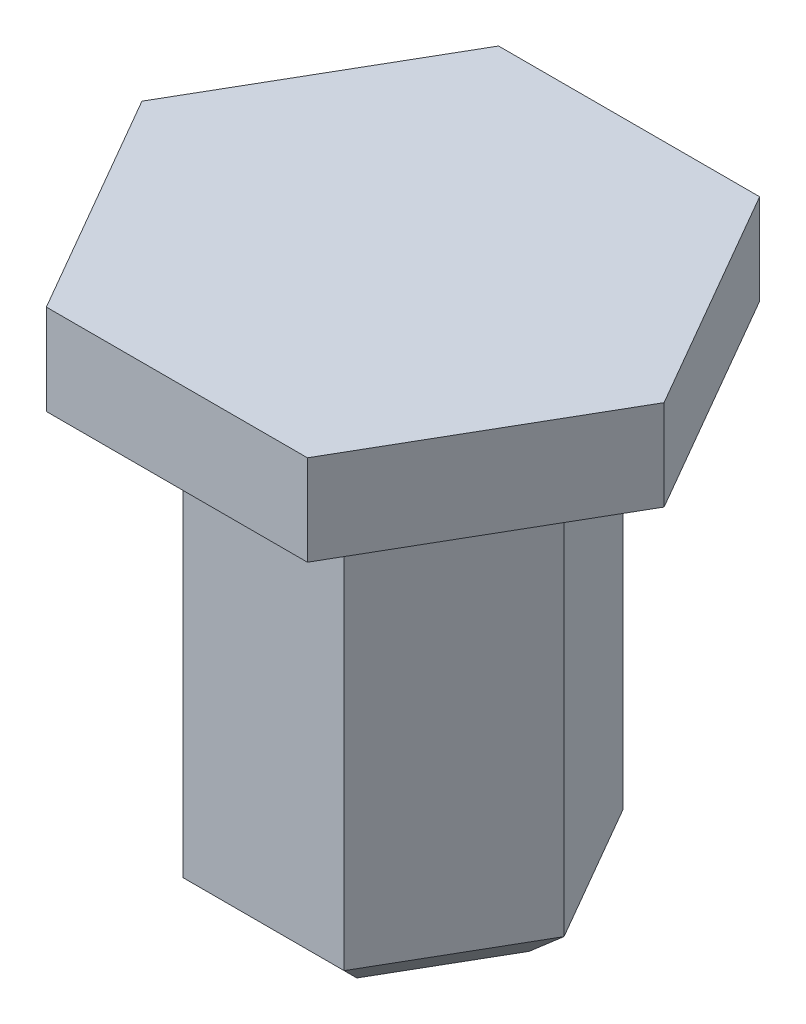
from build123d import *

# Parameters (mm, degrees)
BOSS_EXTRUDE1_DEPTH = 6
BOSS_EXTRUDE2_DEPTH = 1.2
CHAMFER1_SIZE       = 0.4


with BuildPart() as part:
    # Sketch1 → Boss-Extrude1 (new body)
    with BuildSketch(Plane(origin=(0, 0, 0), x_dir=(1, 0, 0), z_dir=(0, 1, 0))):
        Polygon((2.136195996, 0), (1.068097998, 1.85), (-1.068097998, 1.85), (-2.136195996, 0), (-1.068097998, -1.85), (1.068097998, -1.85), align=None)
    extrude(amount=BOSS_EXTRUDE1_DEPTH)

    # Sketch2 → Boss-Extrude2 (add)
    with BuildSketch(Plane(origin=(0, 6, 0), x_dir=(1, 0, 0), z_dir=(0, 1, 0))):
        Polygon((3.464101615, 0), (1.732050808, 3), (-1.732050808, 3), (-3.464101615, 0), (-1.732050808, -3), (1.732050808, -3), align=None)
    extrude(amount=BOSS_EXTRUDE2_DEPTH)

    # Chamfer1
    chamfer1_edges = [part.edges().sort_by_distance(p)[0] for p in [
        (0, 0, 1.85),
        (-1.602146997, 0, 0.925),
        (-1.602146997, 0, -0.925),
        (0, 0, -1.85),
        (1.602146997, 0, -0.925),
        (1.602146997, 0, 0.925),
    ]]
    chamfer(chamfer1_edges, length=CHAMFER1_SIZE)


solid = part.part
